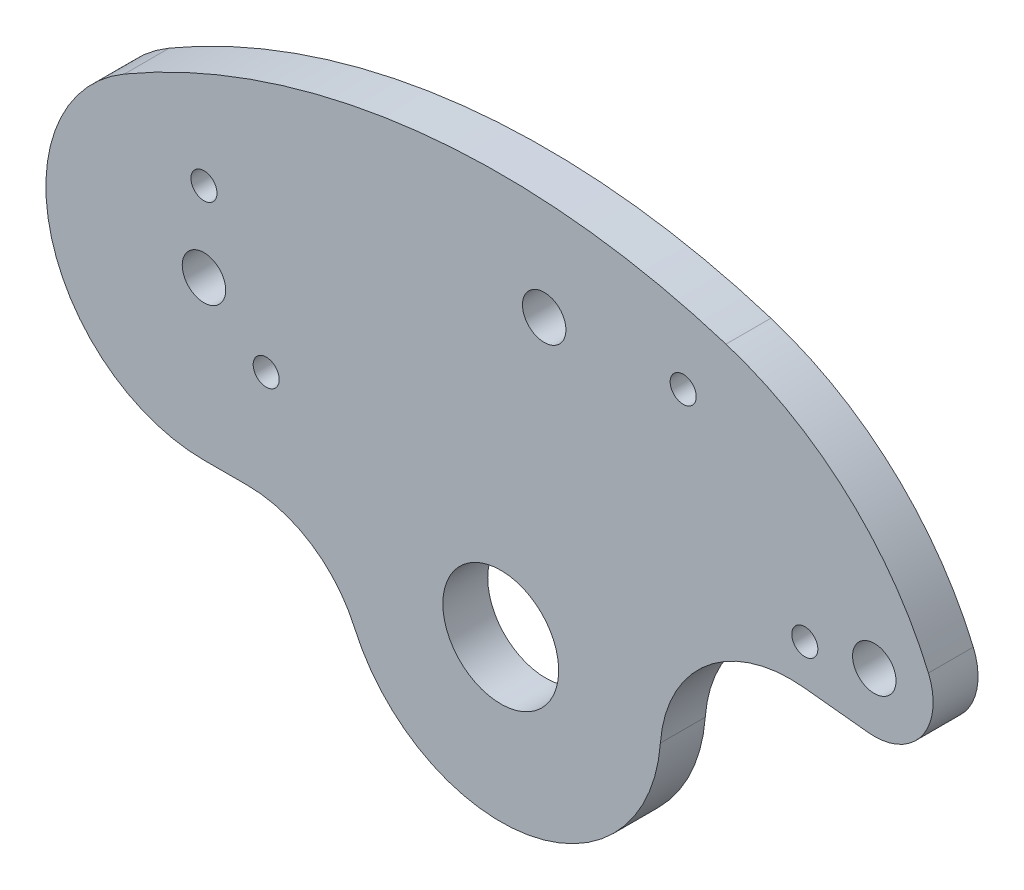
from build123d import *

# Parameters (mm, degrees)
SKETCH1_R           = 3
SKETCH1_R_2         = 8
SKETCH1_R_3         = 1.8
BOSS_EXTRUDE1_DEPTH = 6.2


with BuildPart() as part:
    # Sketch1 → Boss-Extrude1 (new body)
    with BuildSketch(Plane.XY):
        with BuildLine():
            Line((41.889296616, 14.900574245), (50.746753734, 13.965723579))
            ThreePointArc((50.746753734, 13.965723579), (58.138171033, 17.219277376), (59.076989694, 25.240329771))
            ThreePointArc((59.076989694, 25.240329771), (47.870351378, 40.981444556), (31.114327774, 50.604703359))
            ThreePointArc((31.114327774, 50.604703359), (-11.412690469, 54.769217303), (-51.987221097, 41.367802402))
            ThreePointArc((-51.987221097, 41.367802402), (-62.079231834, 16.80974691), (-41, 0.666241851))
            Line((-41, 0.666241851), (-35, 0.666241851))
            ThreePointArc((-35, 0.666241851), (-26.181808949, -1.950576316), (-20.218406631, -8.953865794))
            ThreePointArc((-20.218406631, -8.953865794), (3.76322615, -21.789763842), (22.050412422, -1.653780932))
            ThreePointArc((22.050412422, -1.653780932), (28.467658292, 10.820459281), (41.889296616, 14.900574245))
        make_face()
        with Locations(Location((-41, 22.5, 0), (0, 0, 180))):
            Circle(SKETCH1_R, mode=Mode.SUBTRACT)
        with Locations(Location((6, 41.25, 0), (0, 0, 180))):
            Circle(SKETCH1_R, mode=Mode.SUBTRACT)
        with Locations(Location((51.6, 22.050001086, 0), (0, 0, 180))):
            Circle(SKETCH1_R, mode=Mode.SUBTRACT)
        with Locations(Location((0, 0, 0), (0, 0, 180))):
            Circle(SKETCH1_R_2, mode=Mode.SUBTRACT)
        with Locations(Location((25.2, 42.25, 0), (0, 0, 180))):
            Circle(SKETCH1_R_3, mode=Mode.SUBTRACT)
        with Locations(Location((-32.4, 15.5, 0), (0, 0, 180))):
            Circle(SKETCH1_R_3, mode=Mode.SUBTRACT)
        with Locations(Location((42, 20.450001086, 0), (0, 0, 180))):
            Circle(SKETCH1_R_3, mode=Mode.SUBTRACT)
        with Locations(Location((-41, 33.5, 0), (0, 0, 180))):
            Circle(SKETCH1_R_3, mode=Mode.SUBTRACT)
    extrude(amount=BOSS_EXTRUDE1_DEPTH)


solid = part.part
